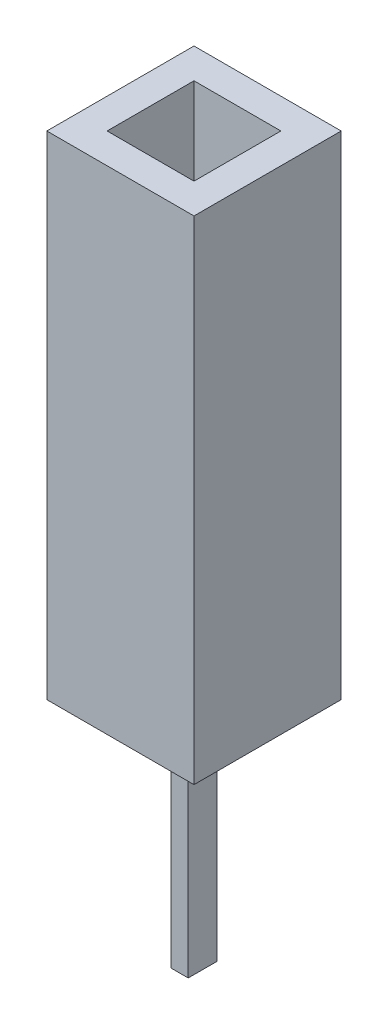
from build123d import *

# Parameters (mm, degrees)
SKETCH_2_W          = 2.54
SKETCH_2_H          = 2.54
EXTRUDE_1_DEPTH     = 8.5
SKETCH_3_W          = 0.3
SKETCH_3_H          = 0.5
EXTRUDE_2_DEPTH     = 3.96
SKETCH_4_W          = 1.5
SKETCH_4_H          = 1.5
CUT_EXTRUDE_1_DEPTH = 7


with BuildPart() as part:
    # 草图2 → 拉伸1 (new body)
    with BuildSketch(Plane(origin=(0, 0, 0), x_dir=(1, 0, 0), z_dir=(0, 1, 0))):
        Rectangle(SKETCH_2_W, SKETCH_2_H)
    extrude(amount=EXTRUDE_1_DEPTH)

    # 草图3 → 拉伸2 (add)
    with BuildSketch(Plane.XZ):
        Rectangle(SKETCH_3_W, SKETCH_3_H)
    extrude(amount=EXTRUDE_2_DEPTH)

    # 草图4 → 切除-拉伸1 (cut)
    with BuildSketch(Plane(origin=(0, 8.5, 0), x_dir=(-1, 0, 0), z_dir=(0, 1, 0))):
        Rectangle(SKETCH_4_W, SKETCH_4_H)
    extrude(amount=-CUT_EXTRUDE_1_DEPTH, mode=Mode.SUBTRACT)


solid = part.part
